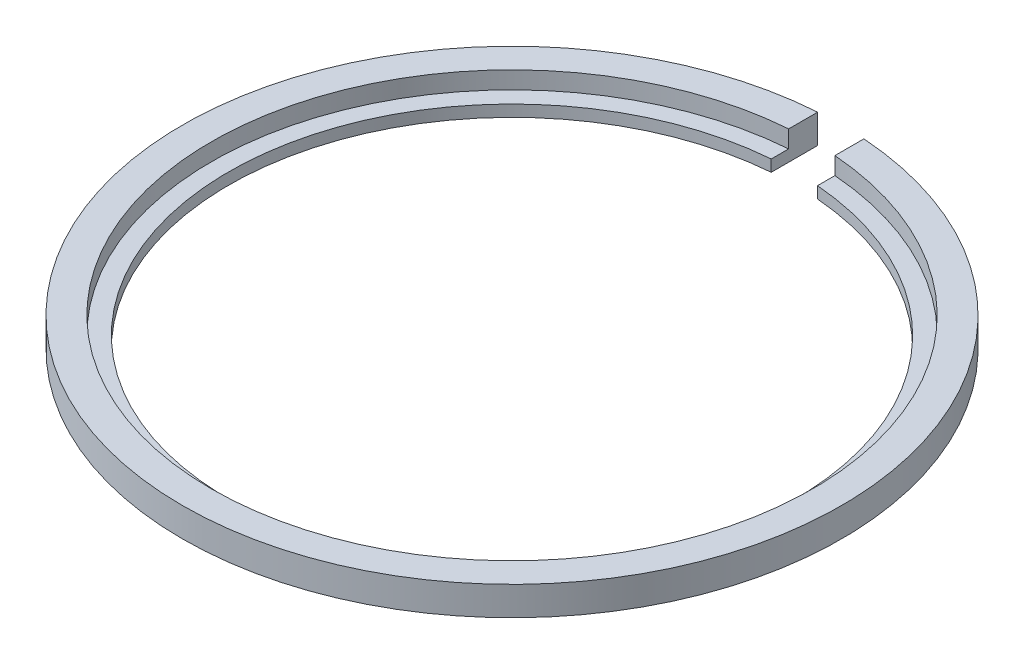
from build123d import *

# Parameters (mm, degrees)
SKETCH_2_W          = 4
SKETCH_2_H          = 52
CUT_EXTRUDE_5_DEPTH = 41.382545735


with BuildPart() as part:
    # Эскиз1 → Повернуть1 (revolve)
    with BuildSketch(Plane.XY, mode=Mode.PRIVATE) as revolve_1_sk:
        Polygon((24.5, 0), (28.5, 0), (28.5, 2.5), (26, 2.5), (26, 1), (24.5, 1), align=None)
    revolve(revolve_1_sk.sketch.rotate(Axis((0, 27.258538146, 0), (0, -1, 0)), 90), axis=Axis((0, 27.258538146, 0), (0, -1, 0)))

    # Эскиз2 → Вырез-Вытянуть5 (cut, through all)
    with BuildSketch(Plane(origin=(0, 0, 0), x_dir=(1, 0, 0), z_dir=(0, 1, 0))):
        with Locations((0, 26)):
            Rectangle(SKETCH_2_W, SKETCH_2_H)
    extrude(amount=CUT_EXTRUDE_5_DEPTH, mode=Mode.SUBTRACT)


solid = part.part
